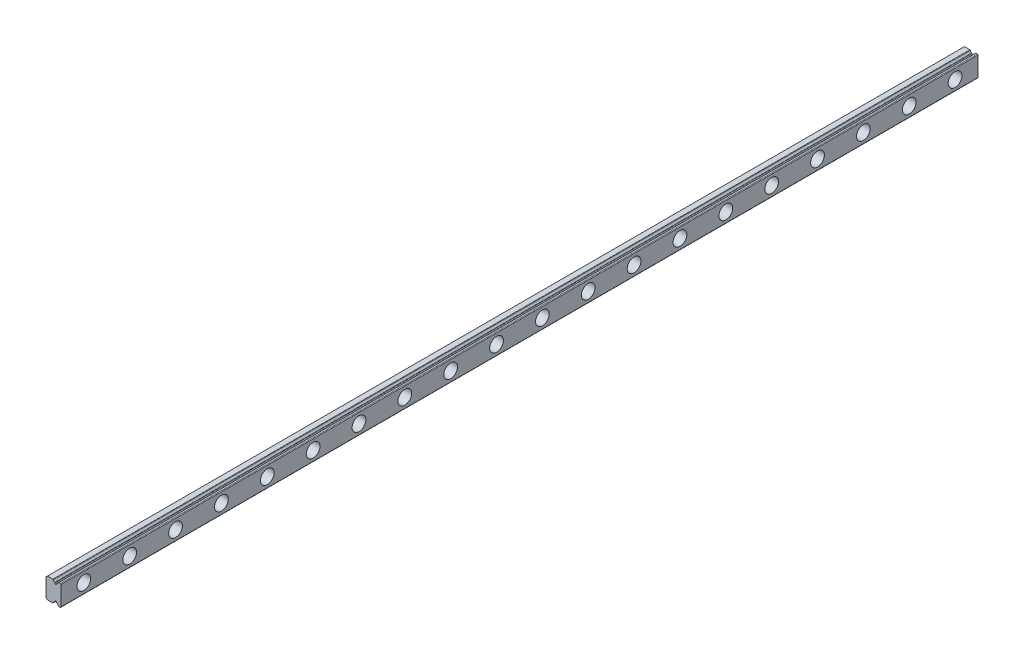
from build123d import *

# Parameters (mm, degrees)
EXTRUDE_1_DEPTH     = 400
SKETCH_2_R          = 3
CUT_EXTRUDE_1_DEPTH = 4.5
SKETCH_3_R          = 1.75
CUT_EXTRUDE_2_DEPTH = 401.126542484


with BuildPart() as part:
    # 草图1 → 凸台-拉伸1 (new body)
    with BuildSketch(Plane.XY):
        with BuildLine():
            ThreePointArc((6.2, 9), (6.412132034, 8.912132034), (6.5, 8.7))
            Line((6.5, 8.7), (6.5, 0.3))
            ThreePointArc((6.5, 0.3), (6.412132034, 0.087867966), (6.2, 0))
            Line((6.2, 0), (5.557669683, 0))
            ThreePointArc((5.557669683, 0), (5.444280341, 0.035249106), (5.370859728, 0.128571429))
            ThreePointArc((5.370859728, 0.128571429), (5.130846451, 0.514929157), (4.764285714, 0.784209483))
            ThreePointArc((4.764285714, 0.784209483), (4.680969149, 0.858006567), (4.65, 0.964911064))
            Line((4.65, 0.964911064), (4.65, 1))
            ThreePointArc((4.65, 1), (4.25, 1.4), (3.85, 1))
            Line((3.85, 1), (3.85, 0.964911064))
            ThreePointArc((3.85, 0.964911064), (3.819030851, 0.858006567), (3.735714286, 0.784209483))
            ThreePointArc((3.735714286, 0.784209483), (3.369153549, 0.514929157), (3.129140272, 0.128571429))
            ThreePointArc((3.129140272, 0.128571429), (3.055719659, 0.035249106), (2.942330317, 0))
            Line((2.942330317, 0), (0.6, 0))
            Line((0.6, 0), (0, 0.6))
            Line((0, 0.6), (0, 8.4))
            Line((0, 8.4), (0.6, 9))
            Line((0.6, 9), (2.942330317, 9))
            ThreePointArc((2.942330317, 9), (3.055719659, 8.964750894), (3.129140272, 8.871428571))
            ThreePointArc((3.129140272, 8.871428571), (3.369153549, 8.485070843), (3.735714286, 8.215790517))
            ThreePointArc((3.735714286, 8.215790517), (3.819030851, 8.141993433), (3.85, 8.035088936))
            Line((3.85, 8.035088936), (3.85, 8))
            ThreePointArc((3.85, 8), (4.25, 7.6), (4.65, 8))
            Line((4.65, 8), (4.65, 8.035088936))
            ThreePointArc((4.65, 8.035088936), (4.680969149, 8.141993433), (4.764285714, 8.215790517))
            ThreePointArc((4.764285714, 8.215790517), (5.130846451, 8.485070843), (5.370859728, 8.871428571))
            ThreePointArc((5.370859728, 8.871428571), (5.444280341, 8.964750894), (5.557669683, 9))
            Line((5.557669683, 9), (6.2, 9))
        make_face()
    extrude(amount=EXTRUDE_1_DEPTH)

    # 草图2 → 切除-拉伸1 (cut)
    with BuildSketch(Plane(origin=(6.5, 0, 0), x_dir=(0, 0, -1), z_dir=(1, 0, 0))):
        with Locations((-10, 4.5)):
            Circle(SKETCH_2_R)
        with Locations((-30, 4.5)):
            Circle(SKETCH_2_R)
        with Locations((-50, 4.5)):
            Circle(SKETCH_2_R)
        with Locations((-70, 4.5)):
            Circle(SKETCH_2_R)
        with Locations((-90, 4.5)):
            Circle(SKETCH_2_R)
        with Locations((-110, 4.5)):
            Circle(SKETCH_2_R)
        with Locations((-130, 4.5)):
            Circle(SKETCH_2_R)
        with Locations((-150, 4.5)):
            Circle(SKETCH_2_R)
        with Locations((-170, 4.5)):
            Circle(SKETCH_2_R)
        with Locations((-190, 4.5)):
            Circle(SKETCH_2_R)
        with Locations((-210, 4.5)):
            Circle(SKETCH_2_R)
        with Locations((-230, 4.5)):
            Circle(SKETCH_2_R)
        with Locations((-250, 4.5)):
            Circle(SKETCH_2_R)
        with Locations((-270, 4.5)):
            Circle(SKETCH_2_R)
        with Locations((-290, 4.5)):
            Circle(SKETCH_2_R)
        with Locations((-310, 4.5)):
            Circle(SKETCH_2_R)
        with Locations((-330, 4.5)):
            Circle(SKETCH_2_R)
        with Locations((-350, 4.5)):
            Circle(SKETCH_2_R)
        with Locations((-370, 4.5)):
            Circle(SKETCH_2_R)
        with Locations((-390, 4.5)):
            Circle(SKETCH_2_R)
        with Locations((-410, 4.5)):
            Circle(SKETCH_2_R)
        with Locations((-430, 4.5)):
            Circle(SKETCH_2_R)
        with Locations((-450, 4.5)):
            Circle(SKETCH_2_R)
        with Locations((-470, 4.5)):
            Circle(SKETCH_2_R)
        with Locations((-490, 4.5)):
            Circle(SKETCH_2_R)
        with Locations((-510, 4.5)):
            Circle(SKETCH_2_R)
        with Locations((-530, 4.5)):
            Circle(SKETCH_2_R)
        with Locations((-550, 4.5)):
            Circle(SKETCH_2_R)
        with Locations((-570, 4.5)):
            Circle(SKETCH_2_R)
        with Locations((-590, 4.5)):
            Circle(SKETCH_2_R)
        with Locations((-610, 4.5)):
            Circle(SKETCH_2_R)
        with Locations((-630, 4.5)):
            Circle(SKETCH_2_R)
        with Locations((-650, 4.5)):
            Circle(SKETCH_2_R)
        with Locations((-670, 4.5)):
            Circle(SKETCH_2_R)
        with Locations((-690, 4.5)):
            Circle(SKETCH_2_R)
        with Locations((-710, 4.5)):
            Circle(SKETCH_2_R)
        with Locations((-730, 4.5)):
            Circle(SKETCH_2_R)
        with Locations((-750, 4.5)):
            Circle(SKETCH_2_R)
        with Locations((-770, 4.5)):
            Circle(SKETCH_2_R)
        with Locations((-790, 4.5)):
            Circle(SKETCH_2_R)
        with Locations((-810, 4.5)):
            Circle(SKETCH_2_R)
        with Locations((-830, 4.5)):
            Circle(SKETCH_2_R)
        with Locations((-850, 4.5)):
            Circle(SKETCH_2_R)
        with Locations((-870, 4.5)):
            Circle(SKETCH_2_R)
        with Locations((-890, 4.5)):
            Circle(SKETCH_2_R)
        with Locations((-910, 4.5)):
            Circle(SKETCH_2_R)
        with Locations((-930, 4.5)):
            Circle(SKETCH_2_R)
        with Locations((-950, 4.5)):
            Circle(SKETCH_2_R)
        with Locations((-970, 4.5)):
            Circle(SKETCH_2_R)
        with Locations((-990, 4.5)):
            Circle(SKETCH_2_R)
        with Locations((-1010, 4.5)):
            Circle(SKETCH_2_R)
        with Locations((-1030, 4.5)):
            Circle(SKETCH_2_R)
        with Locations((-1050, 4.5)):
            Circle(SKETCH_2_R)
        with Locations((-1070, 4.5)):
            Circle(SKETCH_2_R)
        with Locations((-1090, 4.5)):
            Circle(SKETCH_2_R)
        with Locations((-1110, 4.5)):
            Circle(SKETCH_2_R)
        with Locations((-1130, 4.5)):
            Circle(SKETCH_2_R)
        with Locations((-1150, 4.5)):
            Circle(SKETCH_2_R)
        with Locations((-1170, 4.5)):
            Circle(SKETCH_2_R)
        with Locations((-1190, 4.5)):
            Circle(SKETCH_2_R)
        with Locations((-1210, 4.5)):
            Circle(SKETCH_2_R)
        with Locations((-1230, 4.5)):
            Circle(SKETCH_2_R)
        with Locations((-1250, 4.5)):
            Circle(SKETCH_2_R)
        with Locations((-1270, 4.5)):
            Circle(SKETCH_2_R)
        with Locations((-1290, 4.5)):
            Circle(SKETCH_2_R)
        with Locations((-1310, 4.5)):
            Circle(SKETCH_2_R)
        with Locations((-1330, 4.5)):
            Circle(SKETCH_2_R)
        with Locations((-1350, 4.5)):
            Circle(SKETCH_2_R)
        with Locations((-1370, 4.5)):
            Circle(SKETCH_2_R)
        with Locations((-1390, 4.5)):
            Circle(SKETCH_2_R)
        with Locations((-1410, 4.5)):
            Circle(SKETCH_2_R)
        with Locations((-1430, 4.5)):
            Circle(SKETCH_2_R)
        with Locations((-1450, 4.5)):
            Circle(SKETCH_2_R)
        with Locations((-1470, 4.5)):
            Circle(SKETCH_2_R)
        with Locations((-1490, 4.5)):
            Circle(SKETCH_2_R)
        with Locations((-1510, 4.5)):
            Circle(SKETCH_2_R)
        with Locations((-1530, 4.5)):
            Circle(SKETCH_2_R)
        with Locations((-1550, 4.5)):
            Circle(SKETCH_2_R)
        with Locations((-1570, 4.5)):
            Circle(SKETCH_2_R)
        with Locations((-1590, 4.5)):
            Circle(SKETCH_2_R)
        with Locations((-1610, 4.5)):
            Circle(SKETCH_2_R)
        with Locations((-1630, 4.5)):
            Circle(SKETCH_2_R)
        with Locations((-1650, 4.5)):
            Circle(SKETCH_2_R)
        with Locations((-1670, 4.5)):
            Circle(SKETCH_2_R)
        with Locations((-1690, 4.5)):
            Circle(SKETCH_2_R)
        with Locations((-1710, 4.5)):
            Circle(SKETCH_2_R)
        with Locations((-1730, 4.5)):
            Circle(SKETCH_2_R)
        with Locations((-1750, 4.5)):
            Circle(SKETCH_2_R)
        with Locations((-1770, 4.5)):
            Circle(SKETCH_2_R)
        with Locations((-1790, 4.5)):
            Circle(SKETCH_2_R)
        with Locations((-1810, 4.5)):
            Circle(SKETCH_2_R)
        with Locations((-1830, 4.5)):
            Circle(SKETCH_2_R)
        with Locations((-1850, 4.5)):
            Circle(SKETCH_2_R)
        with Locations((-1870, 4.5)):
            Circle(SKETCH_2_R)
        with Locations((-1890, 4.5)):
            Circle(SKETCH_2_R)
        with Locations((-1910, 4.5)):
            Circle(SKETCH_2_R)
        with Locations((-1930, 4.5)):
            Circle(SKETCH_2_R)
        with Locations((-1950, 4.5)):
            Circle(SKETCH_2_R)
        with Locations((-1970, 4.5)):
            Circle(SKETCH_2_R)
        with Locations((-1990, 4.5)):
            Circle(SKETCH_2_R)
        with Locations((-2010, 4.5)):
            Circle(SKETCH_2_R)
        with Locations((-2030, 4.5)):
            Circle(SKETCH_2_R)
        with Locations((-2050, 4.5)):
            Circle(SKETCH_2_R)
        with Locations((-2070, 4.5)):
            Circle(SKETCH_2_R)
        with Locations((-2090, 4.5)):
            Circle(SKETCH_2_R)
        with Locations((-2110, 4.5)):
            Circle(SKETCH_2_R)
        with Locations((-2130, 4.5)):
            Circle(SKETCH_2_R)
        with Locations((-2150, 4.5)):
            Circle(SKETCH_2_R)
        with Locations((-2170, 4.5)):
            Circle(SKETCH_2_R)
        with Locations((-2190, 4.5)):
            Circle(SKETCH_2_R)
        with Locations((-2210, 4.5)):
            Circle(SKETCH_2_R)
        with Locations((-2230, 4.5)):
            Circle(SKETCH_2_R)
        with Locations((-2250, 4.5)):
            Circle(SKETCH_2_R)
        with Locations((-2270, 4.5)):
            Circle(SKETCH_2_R)
        with Locations((-2290, 4.5)):
            Circle(SKETCH_2_R)
        with Locations((-2310, 4.5)):
            Circle(SKETCH_2_R)
        with Locations((-2330, 4.5)):
            Circle(SKETCH_2_R)
        with Locations((-2350, 4.5)):
            Circle(SKETCH_2_R)
        with Locations((-2370, 4.5)):
            Circle(SKETCH_2_R)
        with Locations((-2390, 4.5)):
            Circle(SKETCH_2_R)
        with Locations((-2410, 4.5)):
            Circle(SKETCH_2_R)
        with Locations((-2430, 4.5)):
            Circle(SKETCH_2_R)
        with Locations((-2450, 4.5)):
            Circle(SKETCH_2_R)
        with Locations((-2470, 4.5)):
            Circle(SKETCH_2_R)
    extrude(amount=-CUT_EXTRUDE_1_DEPTH, mode=Mode.SUBTRACT)

    # 草图3 → 切除-拉伸2 (cut, through all)
    with BuildSketch(Plane(origin=(2, 0, 0), x_dir=(0, 0, -1), z_dir=(1, 0, 0))):
        with Locations((-10, 4.5)):
            Circle(SKETCH_3_R)
        with Locations((-30, 4.5)):
            Circle(SKETCH_3_R)
        with Locations((-50, 4.5)):
            Circle(SKETCH_3_R)
        with Locations((-70, 4.5)):
            Circle(SKETCH_3_R)
        with Locations((-90, 4.5)):
            Circle(SKETCH_3_R)
        with Locations((-110, 4.5)):
            Circle(SKETCH_3_R)
        with Locations((-130, 4.5)):
            Circle(SKETCH_3_R)
        with Locations((-150, 4.5)):
            Circle(SKETCH_3_R)
        with Locations((-170, 4.5)):
            Circle(SKETCH_3_R)
        with Locations((-190, 4.5)):
            Circle(SKETCH_3_R)
        with Locations((-210, 4.5)):
            Circle(SKETCH_3_R)
        with Locations((-230, 4.5)):
            Circle(SKETCH_3_R)
        with Locations((-250, 4.5)):
            Circle(SKETCH_3_R)
        with Locations((-270, 4.5)):
            Circle(SKETCH_3_R)
        with Locations((-290, 4.5)):
            Circle(SKETCH_3_R)
        with Locations((-310, 4.5)):
            Circle(SKETCH_3_R)
        with Locations((-330, 4.5)):
            Circle(SKETCH_3_R)
        with Locations((-350, 4.5)):
            Circle(SKETCH_3_R)
        with Locations((-370, 4.5)):
            Circle(SKETCH_3_R)
        with Locations((-390, 4.5)):
            Circle(SKETCH_3_R)
        with Locations((-410, 4.5)):
            Circle(SKETCH_3_R)
        with Locations((-430, 4.5)):
            Circle(SKETCH_3_R)
        with Locations((-450, 4.5)):
            Circle(SKETCH_3_R)
        with Locations((-470, 4.5)):
            Circle(SKETCH_3_R)
        with Locations((-490, 4.5)):
            Circle(SKETCH_3_R)
        with Locations((-510, 4.5)):
            Circle(SKETCH_3_R)
        with Locations((-530, 4.5)):
            Circle(SKETCH_3_R)
        with Locations((-550, 4.5)):
            Circle(SKETCH_3_R)
        with Locations((-570, 4.5)):
            Circle(SKETCH_3_R)
        with Locations((-590, 4.5)):
            Circle(SKETCH_3_R)
        with Locations((-610, 4.5)):
            Circle(SKETCH_3_R)
        with Locations((-630, 4.5)):
            Circle(SKETCH_3_R)
        with Locations((-650, 4.5)):
            Circle(SKETCH_3_R)
        with Locations((-670, 4.5)):
            Circle(SKETCH_3_R)
        with Locations((-690, 4.5)):
            Circle(SKETCH_3_R)
        with Locations((-710, 4.5)):
            Circle(SKETCH_3_R)
        with Locations((-730, 4.5)):
            Circle(SKETCH_3_R)
        with Locations((-750, 4.5)):
            Circle(SKETCH_3_R)
        with Locations((-770, 4.5)):
            Circle(SKETCH_3_R)
        with Locations((-790, 4.5)):
            Circle(SKETCH_3_R)
        with Locations((-810, 4.5)):
            Circle(SKETCH_3_R)
        with Locations((-830, 4.5)):
            Circle(SKETCH_3_R)
        with Locations((-850, 4.5)):
            Circle(SKETCH_3_R)
        with Locations((-870, 4.5)):
            Circle(SKETCH_3_R)
        with Locations((-890, 4.5)):
            Circle(SKETCH_3_R)
        with Locations((-910, 4.5)):
            Circle(SKETCH_3_R)
        with Locations((-930, 4.5)):
            Circle(SKETCH_3_R)
        with Locations((-950, 4.5)):
            Circle(SKETCH_3_R)
        with Locations((-970, 4.5)):
            Circle(SKETCH_3_R)
        with Locations((-990, 4.5)):
            Circle(SKETCH_3_R)
        with Locations((-1010, 4.5)):
            Circle(SKETCH_3_R)
        with Locations((-1030, 4.5)):
            Circle(SKETCH_3_R)
        with Locations((-1050, 4.5)):
            Circle(SKETCH_3_R)
        with Locations((-1070, 4.5)):
            Circle(SKETCH_3_R)
    extrude(amount=-CUT_EXTRUDE_2_DEPTH, mode=Mode.SUBTRACT)


solid = part.part
